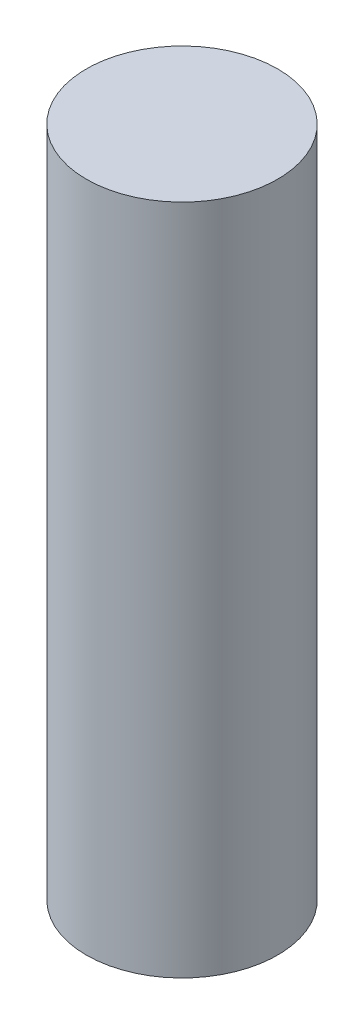
from build123d import *

# Parameters (mm, degrees)
SKETCH_1_R      = 1.85
EXTRUDE_1_DEPTH = 13


with BuildPart() as part:
    # 草图1 → 凸台-拉伸1 (new body)
    with BuildSketch(Plane(origin=(0, 0, 0), x_dir=(1, 0, 0), z_dir=(0, 1, 0))):
        with Locations(Location((0, 0, 0), (0, 0, 90))):
            Circle(SKETCH_1_R)
    extrude(amount=EXTRUDE_1_DEPTH)


solid = part.part
